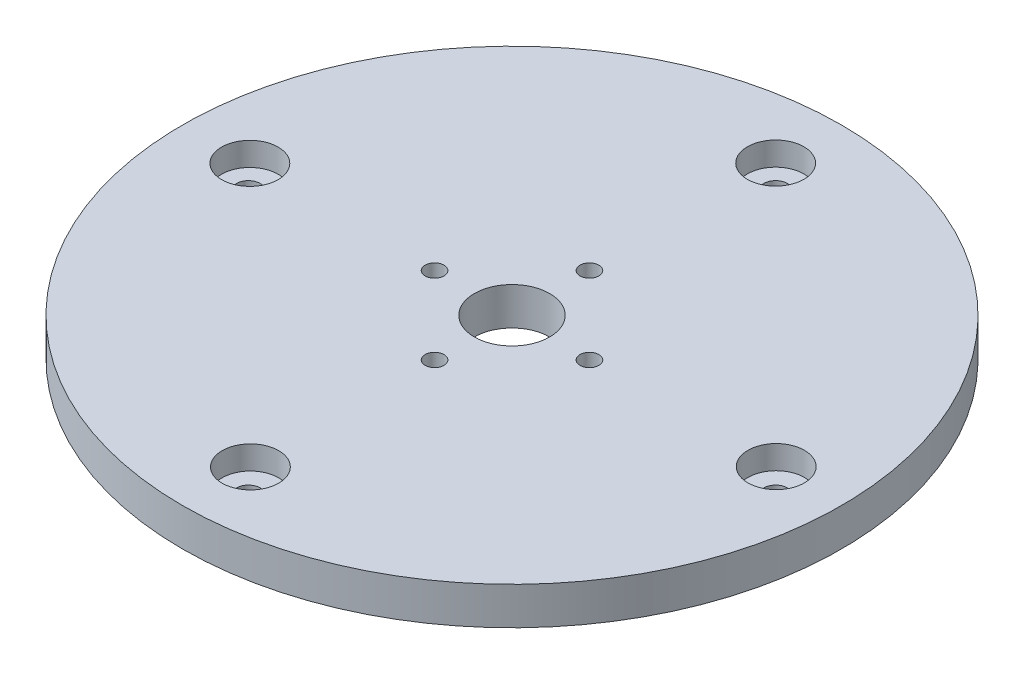
from build123d import *

# Parameters (mm, degrees)
SKETCH1_R           = 35
BOSS_EXTRUDE1_DEPTH = 4
SKETCH2_R           = 1
SKETCH2_R_2         = 1.25
CUT_EXTRUDE1_DEPTH  = 50.658836072
CUT_EXTRUDE2_REACH  = 51.659
SKETCH3_R           = 4
SKETCH4_R           = 3
CUT_EXTRUDE3_DEPTH  = 2.5
SKETCH5_R           = 2
CUT_EXTRUDE4_DEPTH  = 2.5


with BuildPart() as part:
    # Sketch1 → Boss-Extrude1 (new body)
    with BuildSketch(Plane(origin=(0, 0, 0), x_dir=(1, 0, 0), z_dir=(0, 1, 0))):
        with Locations(Location((0, 0, 0), (0, 0, 270))):
            Circle(SKETCH1_R)
    extrude(amount=BOSS_EXTRUDE1_DEPTH)

    # Sketch2 → Cut-Extrude1 (cut, through all)
    with BuildSketch(Plane(origin=(0, 4, 0), x_dir=(1, 0, 0), z_dir=(0, 1, 0))):
        with Locations(Location((0, 8.227062517, 0), (0, 0, 270))):
            Circle(SKETCH2_R)
        with Locations(Location((8.227062517, 0, 0), (0, 0, 270))):
            Circle(SKETCH2_R)
        with Locations(Location((0, -8.227062517, 0), (0, 0, 270))):
            Circle(SKETCH2_R)
        with Locations(Location((-8.227062517, 0, 0), (0, 0, 270))):
            Circle(SKETCH2_R)
        with Locations(Location((0, -28, 0), (0, 0, 90))):
            Circle(SKETCH2_R_2)
        with Locations(Location((-28, 0, 0), (0, 0, 90))):
            Circle(SKETCH2_R_2)
        with Locations(Location((0, 28, 0), (0, 0, 90))):
            Circle(SKETCH2_R_2)
        with Locations(Location((28, 0, 0), (0, 0, 90))):
            Circle(SKETCH2_R_2)
    extrude(amount=-CUT_EXTRUDE1_DEPTH, mode=Mode.SUBTRACT)

    # Sketch3 → Cut-Extrude2 (cut, up to next)
    with BuildSketch(Plane.XZ, mode=Mode.PRIVATE) as cut_extrude2_sk1:
        with Locations(Location((0, 0, 0), (0, 0, 270))):
            Circle(SKETCH3_R)
    cut_extrude2_tool1 = extrude(cut_extrude2_sk1.sketch, amount=-CUT_EXTRUDE2_REACH, mode=Mode.PRIVATE) & part.part
    add(cut_extrude2_tool1.solids().sort_by_distance((0, 0, 0))[0], mode=Mode.SUBTRACT)

    # Sketch4 → Cut-Extrude3 (cut)
    with BuildSketch(Plane(origin=(0, 4, 0), x_dir=(1, 0, 0), z_dir=(0, 1, 0))):
        with Locations(Location((0, 28, 0), (0, 0, 270))):
            Circle(SKETCH4_R)
        with Locations(Location((27.948073418, 0.109503391, 0), (0, 0, 270))):
            Circle(SKETCH4_R)
        with Locations(Location((0.057576809, -27.838570027, 0), (0, 0, 270))):
            Circle(SKETCH4_R)
        with Locations(Location((-27.890496609, 0.051926582, 0), (0, 0, 270))):
            Circle(SKETCH4_R)
    extrude(amount=-CUT_EXTRUDE3_DEPTH, mode=Mode.SUBTRACT)

    # Sketch5 → Cut-Extrude4 (cut)
    with BuildSketch(Plane.XZ):
        with Locations(Location((0, 8.227062517, 0), (0, 0, 270))):
            Circle(SKETCH5_R)
        with Locations(Location((8.227062517, 0, 0), (0, 0, 270))):
            Circle(SKETCH5_R)
        with Locations(Location((0, -8.227062517, 0), (0, 0, 270))):
            Circle(SKETCH5_R)
        with Locations(Location((-8.227062517, 0, 0), (0, 0, 270))):
            Circle(SKETCH5_R)
    extrude(amount=-CUT_EXTRUDE4_DEPTH, mode=Mode.SUBTRACT)


solid = part.part
